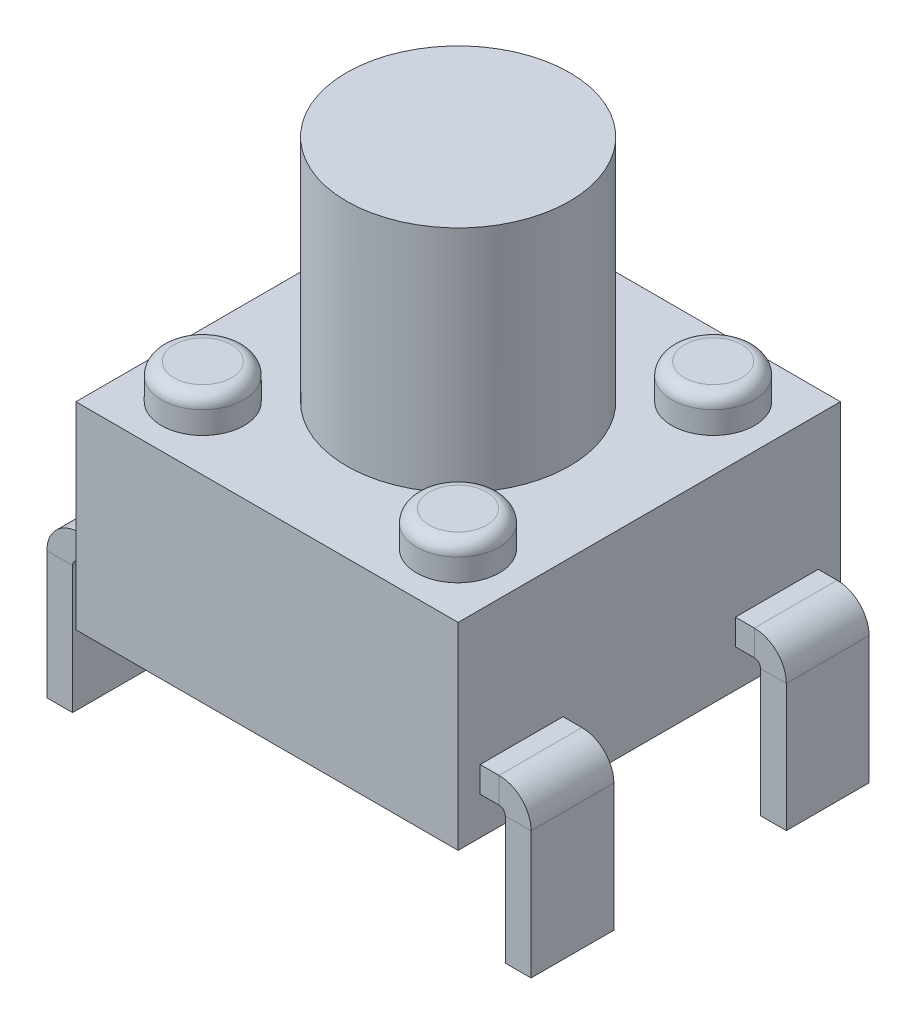
from build123d import *

# Parameters (mm, degrees)
SKETCH_1_W      = 6
SKETCH_1_H      = 6
EXTRUDE_1_DEPTH = 3.1
SKETCH_2_R      = 1.75
EXTRUDE_2_DEPTH = 3.6
SKETCH_8_W      = 1.302494735
SKETCH_8_H      = 0.403244053
SKETCH_8_W_2    = 1.3
SKETCH_3_R      = 0.65
SKETCH_3_R_2    = 0.651247367
EXTRUDE_5_DEPTH = 0.55
FILLET_1_R      = 0.2
FILLET_2_R      = 0.2
FILLET_3_R      = 0.2
FILLET_4_R      = 0.2
SKETCH_13_W     = 1.29992486
SKETCH_13_H     = 0.404320481
SKETCH_13_W_2   = 1.3


with BuildPart() as part:
    # Эскиз1 → Бобышка-Вытянуть1 (new body)
    with BuildSketch(Plane(origin=(0, 0, 0), x_dir=(1, 0, 0), z_dir=(0, 1, 0))):
        Rectangle(SKETCH_1_W, SKETCH_1_H)
    extrude(amount=EXTRUDE_1_DEPTH)

    # Эскиз2 → Бобышка-Вытянуть2 (add)
    with BuildSketch(Plane(origin=(0, 3.1, 0), x_dir=(1, 0, 0), z_dir=(0, 1, 0))):
        with Locations(Location((0, 0, 0), (0, 0, 90))):
            Circle(SKETCH_2_R)
    extrude(amount=EXTRUDE_2_DEPTH)

    # По траектории11: sweep along a path in Эскиз11
    with BuildLine(Plane.XY) as sweep_11_path:
        Line((-3, 0.80118086), (-3.3, 0.80118086))
        ThreePointArc((-3.3, 0.80118086), (-3.512132034, 0.713312895), (-3.6, 0.50118086))
        Line((-3.6, 0.50118086), (-3.6, -1.49881914))
    # Эскиз8 → По траектории11 (sweep)
    with BuildSketch(Plane.ZY.offset(3)):
        with Locations((-2.002333521, 0.801180861)):
            Rectangle(SKETCH_8_W, SKETCH_8_H)
        with Locations((2.004025026, 0.801180861)):
            Rectangle(SKETCH_8_W_2, SKETCH_8_H)
    sweep(path=sweep_11_path.line)

    # Эскиз3 → Бобышка-Вытянуть5 (add)
    with BuildSketch(Plane(origin=(0, 3.1, 0), x_dir=(1, 0, 0), z_dir=(0, 1, 0))):
        with Locations(Location((-2.004298807, -2.004025026, 0), (0, 0, 90))):
            Circle(SKETCH_3_R)
        with Locations(Location((-2.004298807, 2.002333521, 0), (0, 0, 90))):
            Circle(SKETCH_3_R_2)
        with Locations(Location((2.001283613, 2.002333521, 0), (0, 0, 90))):
            Circle(SKETCH_3_R)
        with Locations(Location((2.001283613, -2.004025026, 0), (0, 0, 90))):
            Circle(SKETCH_3_R)
    extrude(amount=EXTRUDE_5_DEPTH)

    # Скругление1
    fillet_1_edges = [part.edges().sort_by_distance(p)[0] for p in [
        (2.001283613, 3.65, 2.654025026),
    ]]
    fillet(fillet_1_edges, radius=FILLET_1_R)

    # Скругление2
    fillet_2_edges = [part.edges().sort_by_distance(p)[0] for p in [
        (-2.004298807, 3.65, 2.654025026),
    ]]
    fillet(fillet_2_edges, radius=FILLET_2_R)

    # Скругление3
    fillet_3_edges = [part.edges().sort_by_distance(p)[0] for p in [
        (2.001283613, 3.65, -1.352333521),
    ]]
    fillet(fillet_3_edges, radius=FILLET_3_R)

    # Скругление4
    fillet_4_edges = [part.edges().sort_by_distance(p)[0] for p in [
        (-2.004298807, 3.65, -1.351086153),
    ]]
    fillet(fillet_4_edges, radius=FILLET_4_R)

    # По траектории12: sweep along a path in Эскиз14
    with BuildLine(Plane.XY) as sweep_12_path:
        Line((3, 0.793292299), (3.29676564, 0.793292299))
        ThreePointArc((3.29676564, 0.793292299), (3.508897675, 0.705424334), (3.59676564, 0.493292299))
        Line((3.59676564, 0.493292299), (3.59676564, -1.507497103))
    # Эскиз13 → По траектории12 (sweep)
    with BuildSketch(Plane(origin=(3, 0, 0), x_dir=(0, 0, -1), z_dir=(1, 0, 0))):
        with Locations((-2.004083718, 0.7932923)):
            Rectangle(SKETCH_13_W, SKETCH_13_H)
        with Locations((2.002333521, 0.7932923)):
            Rectangle(SKETCH_13_W_2, SKETCH_13_H)
    sweep(path=sweep_12_path.line)


solid = part.part
